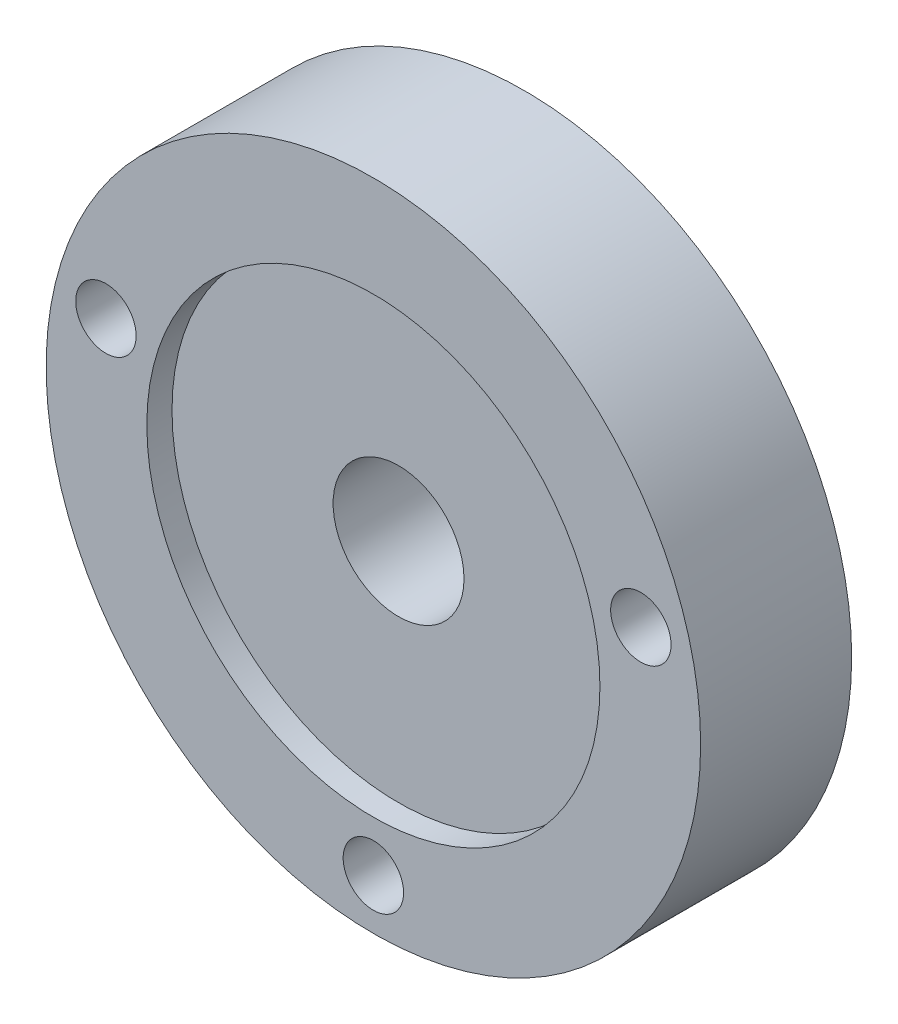
from build123d import *

# Parameters (mm, degrees)
ESQUISSE1_R                = 32.5
BOSS_EXTRU_1_DEPTH         = 15
ESQUISSE2_R                = 22.5
ENL_V_MAT_EXTRU_1_DEPTH    = 2.5
ESQUISSE3_R                = 6.5
ENL_V_MAT_EXTRU_2_DEPTH    = 48.631397208
TROUS_DE_CENTRAGE_6_0MM1_D = 6
D_GAGEMENT_M61_D           = 6.6
D_GAGEMENT_M61_DEPTH       = 5
D_GAGEMENT_M61_TIP         = 1.905255888
D_GAGEMENT_M31_D           = 3.4
D_GAGEMENT_M31_DEPTH       = 5
D_GAGEMENT_M31_TIP         = 0.981495458
D_GAGEMENT_M32_D           = 3.4
D_GAGEMENT_M32_DEPTH       = 5
D_GAGEMENT_M32_TIP         = 0.981495458


with BuildPart() as part:
    # Esquisse1 → Boss.-Extru.1 (new body)
    with BuildSketch(Plane.XY):
        Circle(ESQUISSE1_R)
    extrude(amount=BOSS_EXTRU_1_DEPTH)

    # Esquisse2 → Enlèv. mat.-Extru.1 (cut)
    with BuildSketch(Plane.XY.offset(15)):
        Circle(ESQUISSE2_R)
    extrude(amount=-ENL_V_MAT_EXTRU_1_DEPTH, mode=Mode.SUBTRACT)

    # Esquisse3 → Enlèv. mat.-Extru.2 (cut, through all)
    with BuildSketch(Plane.XY.offset(12.5)):
        Circle(ESQUISSE3_R)
    extrude(amount=-ENL_V_MAT_EXTRU_2_DEPTH, mode=Mode.SUBTRACT)

    # Trous de centrage Ø6.0mm1 (through all)
    with Locations(Plane.XY.offset(15)):
        with Locations((0, -27.5), (-26.562960223, 7.11752374), (26.562960223, 7.11752374)):
            Hole(TROUS_DE_CENTRAGE_6_0MM1_D / 2)

    # Dégagement M61
    with Locations(Plane(origin=(0, 0, 0), x_dir=(-1, 0, 0), z_dir=(0, 0, -1))):
        with Locations((-11.303753991, 11.241031035), (9.107378233, 13.084009123), (14.466713258, -6.697002353)):
            Hole(D_GAGEMENT_M61_D / 2, depth=D_GAGEMENT_M61_DEPTH)
            with Locations((0, 0, -(D_GAGEMENT_M61_DEPTH + D_GAGEMENT_M61_TIP / 2))):  # 120° drill point
                Cone(0, D_GAGEMENT_M61_D / 2, D_GAGEMENT_M61_TIP, mode=Mode.SUBTRACT)

    # Dégagement M31
    with Locations(Plane(origin=(0, 0, 0), x_dir=(-1, 0, 0), z_dir=(0, 0, -1))):
        with Locations((22.298556593, -9.388080653), (21.906177888, 10.608069951)):
            Hole(D_GAGEMENT_M31_D / 2, depth=D_GAGEMENT_M31_DEPTH)
            with Locations((0, 0, -(D_GAGEMENT_M31_DEPTH + D_GAGEMENT_M31_TIP / 2))):  # 120° drill point
                Cone(0, D_GAGEMENT_M31_D / 2, D_GAGEMENT_M31_TIP, mode=Mode.SUBTRACT)

    # Dégagement M32
    with Locations(Plane(origin=(0, 0, 0), x_dir=(-1, 0, 0), z_dir=(0, 0, -1))):
        with Locations((-21.92383493, -9.708243173), (-22.298556593, 9.388080653)):
            Hole(D_GAGEMENT_M32_D / 2, depth=D_GAGEMENT_M32_DEPTH)
            with Locations((0, 0, -(D_GAGEMENT_M32_DEPTH + D_GAGEMENT_M32_TIP / 2))):  # 120° drill point
                Cone(0, D_GAGEMENT_M32_D / 2, D_GAGEMENT_M32_TIP, mode=Mode.SUBTRACT)


solid = part.part
